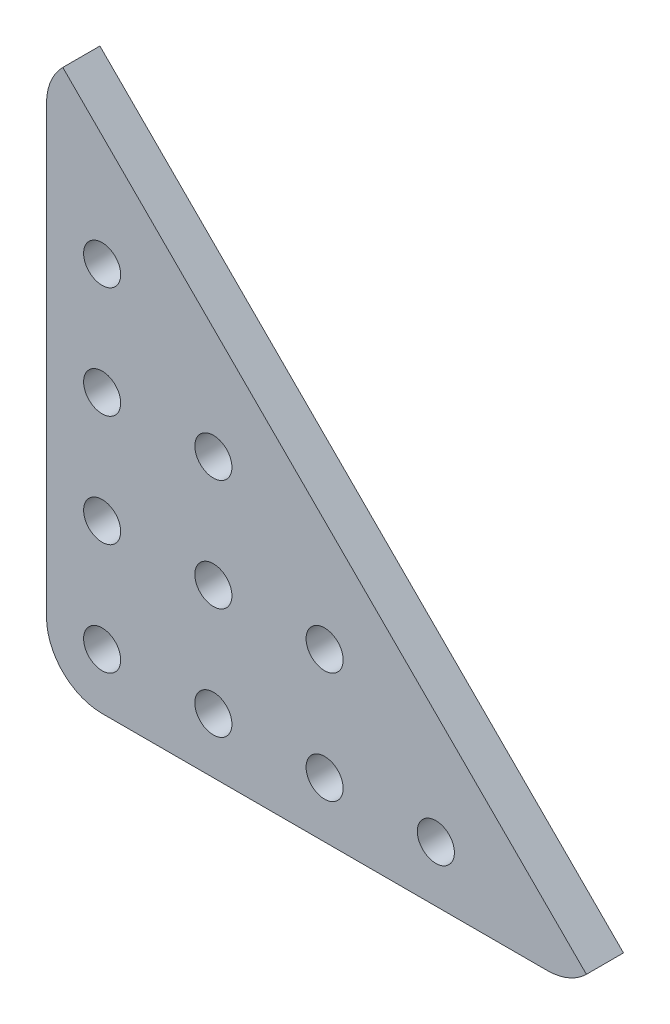
from build123d import *

# Parameters (mm, degrees)
MODEL_R                 = 1.5
SALIENTE_EXTRUIR1_DEPTH = 3


with BuildPart() as part:
    # Model → Saliente-Extruir1 (new body)
    with BuildSketch(Plane.XY):
        with BuildLine():
            Line((-105.943383637, 101.056539338), (-105.943383637, 65.056539338))
            ThreePointArc((-105.943383637, 65.056539338), (-104.625364152, 61.874558823), (-101.443383637, 60.556539338))
            Line((-101.443383637, 60.556539338), (-65.443383637, 60.556539338))
            ThreePointArc((-65.443383637, 60.556539338), (-63.721308191, 60.899081442), (-62.261403122, 61.874558823))
            Line((-62.261403122, 61.874558823), (-104.625364152, 104.238519853))
            ThreePointArc((-104.625364152, 104.238519853), (-105.600841533, 102.778614784), (-105.943383637, 101.056539338))
        make_face()
        with Locations((-101.443383637, 92.056539338)):
            Circle(MODEL_R, mode=Mode.SUBTRACT)
        with Locations((-101.443383637, 83.056539338)):
            Circle(MODEL_R, mode=Mode.SUBTRACT)
        with Locations((-92.443383637, 83.056539338)):
            Circle(MODEL_R, mode=Mode.SUBTRACT)
        with Locations((-101.443383637, 74.056539338)):
            Circle(MODEL_R, mode=Mode.SUBTRACT)
        with Locations((-92.443383637, 74.056539338)):
            Circle(MODEL_R, mode=Mode.SUBTRACT)
        with Locations((-83.443383637, 74.056539338)):
            Circle(MODEL_R, mode=Mode.SUBTRACT)
        with Locations((-101.443383637, 65.056539338)):
            Circle(MODEL_R, mode=Mode.SUBTRACT)
        with Locations((-92.443383637, 65.056539338)):
            Circle(MODEL_R, mode=Mode.SUBTRACT)
        with Locations((-83.443383637, 65.056539338)):
            Circle(MODEL_R, mode=Mode.SUBTRACT)
        with Locations((-74.443383637, 65.056539338)):
            Circle(MODEL_R, mode=Mode.SUBTRACT)
    extrude(amount=SALIENTE_EXTRUIR1_DEPTH)


solid = part.part
